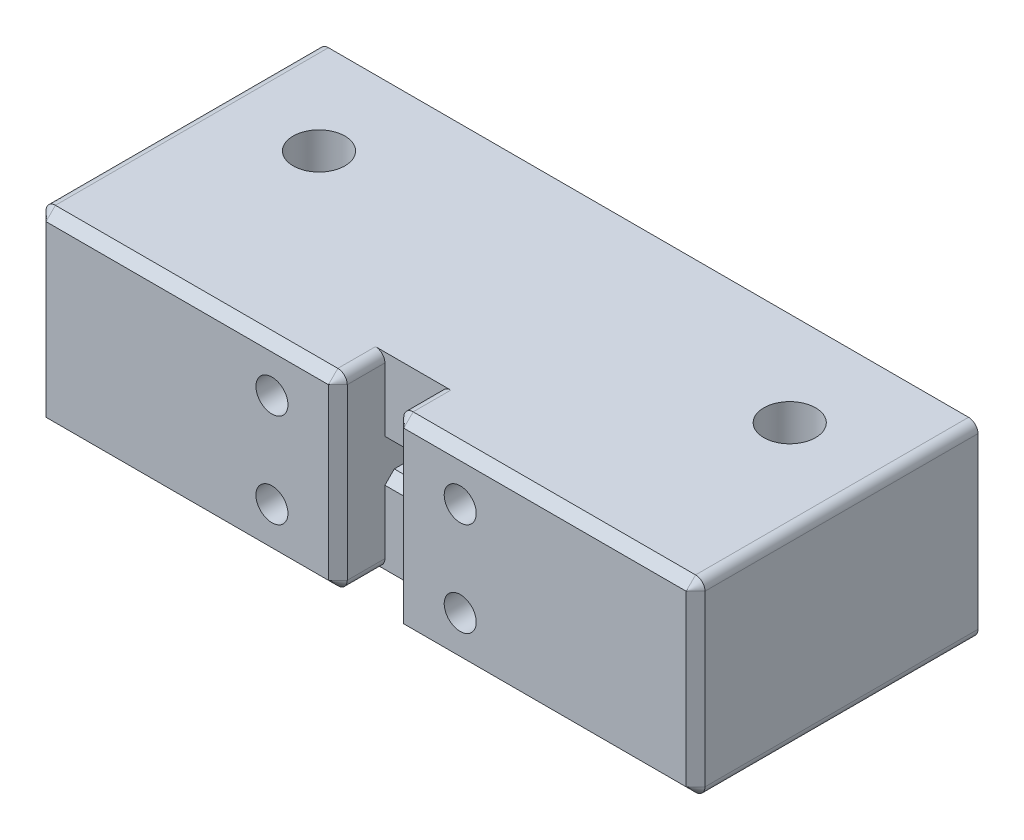
from build123d import *

# Parameters (mm, degrees)
MAIN_BLOCK_SKETCH_W          = 70
MAIN_BLOCK_SKETCH_H          = 20
MAIN_BLOCK_DEPTH             = 25
THICKER_SECTION_SKETCH_W     = 32
THICKER_SECTION_SKETCH_H     = 20
THICKER_SECTION_DEPTH        = 5
BELT_TRAP_CUT_SKETCH_W       = 6
BELT_TRAP_CUT_SKETCH_H       = 2.5
BELT_TRAP_CUT_DEPTH          = 45.158804332
BELT_HOLDER_MOUNTING_HOLES_D = 3.4
NUT_TRAPS_DEPTH              = 2.3
MOUNTING_HOLES_D             = 5.5
MOUNTING_HOLES_CBORE_D       = 10
MOUNTING_HOLES_CBORE_DEPTH   = 5.4
PRINT_HELPER_FILLETS_R       = 1
BELT_GUIDE_CHAMFERS_SIZE     = 1
COSMETIC_CHAMFERS_SIZE       = 1


with BuildPart() as part:
    # Main Block Sketch → Main Block (new body)
    with BuildSketch(Plane.XY):
        Rectangle(MAIN_BLOCK_SKETCH_W, MAIN_BLOCK_SKETCH_H)
    extrude(amount=MAIN_BLOCK_DEPTH)

    # Thicker Section Sketch → Thicker Section (add)
    with BuildSketch(Plane.XY.offset(25)):
        with Locations((19, 0)):
            Rectangle(THICKER_SECTION_SKETCH_W, THICKER_SECTION_SKETCH_H)
        with Locations((-19, 0)):
            Rectangle(THICKER_SECTION_SKETCH_W, THICKER_SECTION_SKETCH_H)
    extrude(amount=THICKER_SECTION_DEPTH)

    # Belt Trap Cut Sketch → Belt Trap Cut (cut, through all)
    with BuildSketch(Plane.XY.offset(25)):
        Rectangle(BELT_TRAP_CUT_SKETCH_W, BELT_TRAP_CUT_SKETCH_H)
    extrude(amount=-BELT_TRAP_CUT_DEPTH, mode=Mode.SUBTRACT)

    # Belt Holder Mounting Holes (through all)
    with Locations(Plane.XY.offset(30)):
        with Locations((-10, 5), (10, 5), (-10, -5), (10, -5)):
            Hole(BELT_HOLDER_MOUNTING_HOLES_D / 2)

    # Nut Trap Sketch → Nut Traps (cut)
    with BuildSketch(Plane.XY):
        Polygon((11.558845727, 7.7), (8.441154273, 7.7), (6.882308546, 5), (8.441154273, 2.3), (11.558845727, 2.3), (13.117691454, 5), align=None)
        Polygon((-11.558845727, 7.7), (-13.117691454, 5), (-11.558845727, 2.3), (-8.441154273, 2.3), (-6.882308546, 5), (-8.441154273, 7.7), align=None)
        Polygon((-8.441154273, -7.7), (-11.558845727, -7.7), (-13.117691454, -5), (-11.558845727, -2.3), (-8.441154273, -2.3), (-6.882308546, -5), align=None)
        Polygon((13.117691454, -5), (11.558845727, -7.7), (8.441154273, -7.7), (6.882308546, -5), (8.441154273, -2.3), (11.558845727, -2.3), align=None)
    extrude(amount=NUT_TRAPS_DEPTH, mode=Mode.SUBTRACT)

    # Mounting Holes (through all)
    with Locations(Plane(origin=(0, -10, 0), x_dir=(-1, 0, 0), z_dir=(0, -1, 0))):
        with Locations((-25, -10), (25, -10)):
            CounterBoreHole(MOUNTING_HOLES_D / 2, MOUNTING_HOLES_CBORE_D / 2, MOUNTING_HOLES_CBORE_DEPTH)

    # Print Helper Fillets
    print_helper_fillets_edges = [part.edges().sort_by_distance(p)[0] for p in [
        (-3, -10, 27.5),
        (-35, 10, 15),
        (-3, 10, 27.5),
        (-35, -10, 15),
        (3, 10, 27.5),
        (3, -10, 27.5),
        (35, -10, 15),
        (35, 10, 15),
    ]]
    fillet(print_helper_fillets_edges, radius=PRINT_HELPER_FILLETS_R)

    # Belt Guide Chamfers
    belt_guide_chamfers_edges = [part.edges().sort_by_distance(p)[0] for p in [
        (0, 1.25, 25),
        (0, -1.25, 25),
    ]]
    chamfer(belt_guide_chamfers_edges, length=BELT_GUIDE_CHAMFERS_SIZE)

    # Cosmetic Chamfers
    cosmetic_chamfers_edges = [part.edges().sort_by_distance(p)[0] for p in [
        (-3, 0, 30),
        (-19, -10, 30),
        (19, -10, 30),
        (-19, 10, 30),
        (-35, 0, 30),
        (-34.707106781, 9.707106781, 30),
        (-34.707106781, -9.707106781, 30),
        (-3.292893219, 9.707106781, 30),
        (-3.292893219, -9.707106781, 30),
        (3, 0, 30),
        (35, 0, 30),
        (19, 10, 30),
        (34.707106781, 9.707106781, 30),
        (34.707106781, -9.707106781, 30),
        (3.292893219, 9.707106781, 30),
        (3.292893219, -9.707106781, 30),
    ]]
    chamfer(cosmetic_chamfers_edges, length=COSMETIC_CHAMFERS_SIZE)


solid = part.part
